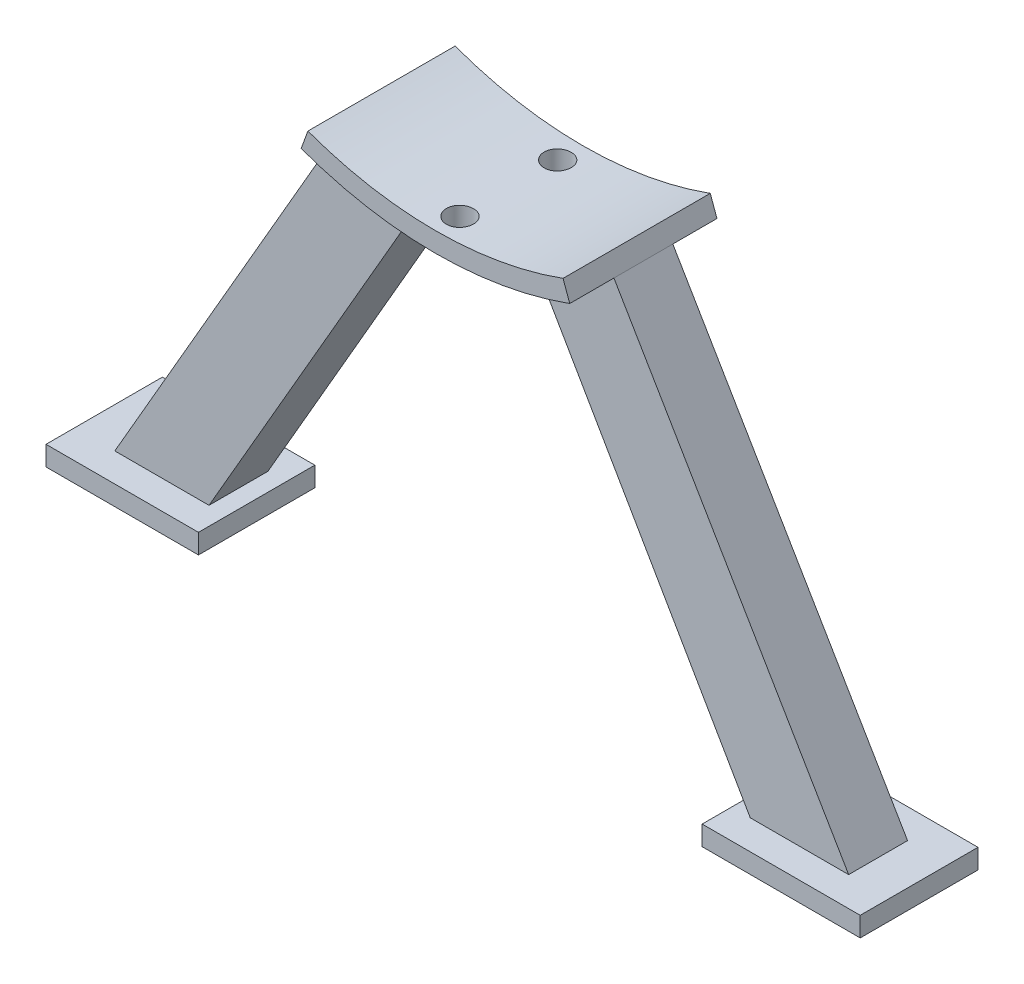
from build123d import *

# Parameters (mm, degrees)
BOSS_EXTRUDE1_DEPTH      = 19.05
BOSS_EXTRUDE2_DEPTH      = 3.81
BOSS_EXTRUDE2_DEPTH_BACK = 3.81
BOSS_EXTRUDE2_START      = -9.525
SKETCH3_W                = 19.725995145
SKETCH3_H                = 15.0557617
SKETCH3_W_2              = 20.448664957
SKETCH3_H_2              = 15.24
BOSS_EXTRUDE3_DEPTH      = 2.54
SKETCH4_R                = 1.7526
CUT_EXTRUDE1_DEPTH       = 9.398


with BuildPart() as part:
    # Sketch1 → Boss-Extrude1 (new body)
    with BuildSketch(Plane.XY):
        with BuildLine():
            ThreePointArc((19.225490484, 2.284288075), (2.719598367, -0.626146046), (-13.78629375, 2.284288075))
            Line((-13.78629375, 2.284288075), (-14.655024914, -0.102531182))
            ThreePointArc((-14.655024914, -0.102531182), (2.719598367, -3.166146046), (20.094221648, -0.102531182))
            Line((20.094221648, -0.102531182), (19.225490484, 2.284288075))
        make_face()
    extrude(amount=BOSS_EXTRUDE1_DEPTH)

    # Sketch2 → Boss-Extrude2 (add, two sides: drawn at the far end of the back side and taken through both)
    with BuildSketch(Plane.XY.offset(19.05).offset(BOSS_EXTRUDE2_START - BOSS_EXTRUDE2_DEPTH_BACK)):
        with BuildLine():
            Line((51.959734492, -54.302617815), (20.094221648, -0.102531182))
            ThreePointArc((20.094221648, -0.102531182), (14.827776239, -1.702056179), (9.419193894, -2.722430855))
            Line((9.419193894, -2.722430855), (39.19902872, -54.302617815))
            Line((39.19902872, -54.302617815), (51.959734492, -54.302617815))
        make_face()
        with BuildLine():
            ThreePointArc((-3.979997159, -2.722430855), (-9.388579504, -1.702056179), (-14.655024914, -0.102531182))
            Line((-14.655024914, -0.102531182), (-45.947459522, -54.302617815))
            Line((-45.947459522, -54.302617815), (-33.759831986, -54.302617815))
            Line((-33.759831986, -54.302617815), (-3.979997159, -2.722430855))
        make_face()
    extrude(amount=BOSS_EXTRUDE2_DEPTH + BOSS_EXTRUDE2_DEPTH_BACK)

    # Sketch3 → Boss-Extrude3 (add)
    with BuildSketch(Plane.XZ.offset(54.302617815)):
        with Locations((-39.812829559, 9.514418368)):
            Rectangle(SKETCH3_W, SKETCH3_H)
        with Locations((45.545402014, 9.525)):
            Rectangle(SKETCH3_W_2, SKETCH3_H_2)
    extrude(amount=-BOSS_EXTRUDE3_DEPTH)

    # Sketch4 → Cut-Extrude1 (cut)
    with BuildSketch(Plane(origin=(0, 0, 0), x_dir=(1, 0, 0), z_dir=(0, 1, 0))):
        with Locations(Location((2.719598367, -3.236263, 0), (0, 0, 270))):
            Circle(SKETCH4_R)
        with Locations(Location((2.719598367, -15.875, 0), (0, 0, 270))):
            Circle(SKETCH4_R)
    extrude(amount=-CUT_EXTRUDE1_DEPTH, mode=Mode.SUBTRACT)


solid = part.part
